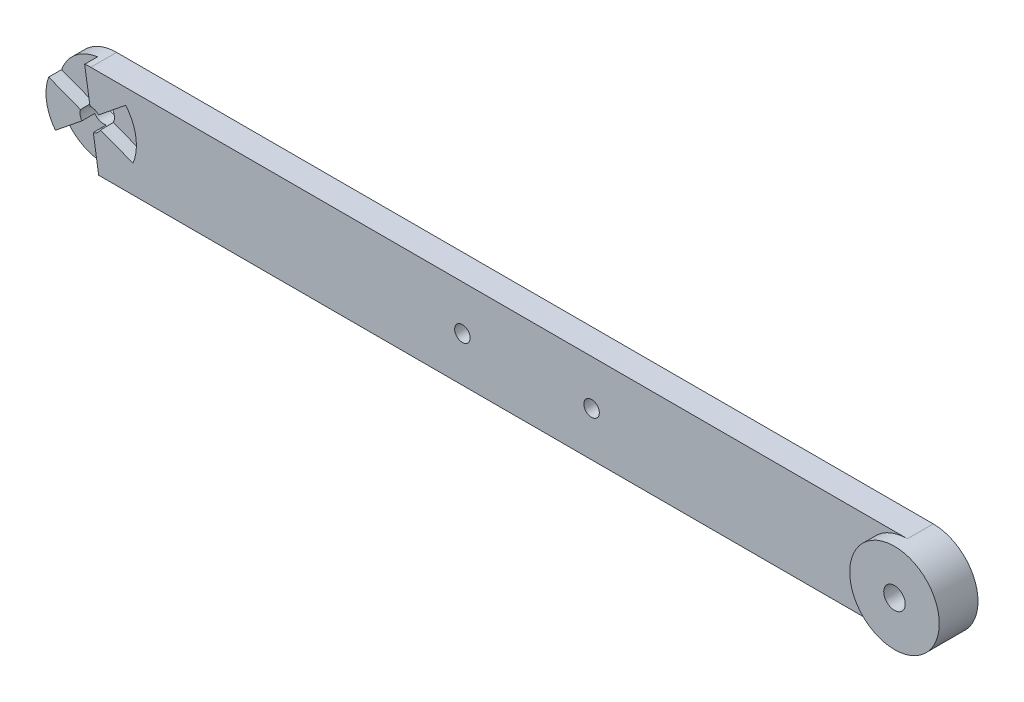
from build123d import *
from build123d.topology import SkipClean

# Parameters (mm, degrees)
SKETCH1_R            = 2.5
BOSS_EXTRUDE1_DEPTH  = 6
CUT_EXTRUDE3_DEPTH   = 3
BOSS_EXTRUDE2_START  = 3
SKETCH4_R            = 2.5
BOSS_EXTRUDE2_DEPTH  = 3
M3_CLEARANCE_HOLE1_D = 3.6


with BuildPart() as part:
    # Sketch1 → Boss-Extrude1 (new body)
    with BuildSketch(Plane.XY):
        with BuildLine():
            Line((189.7, -10.4), (0, -10.4))
            ThreePointArc((0, -10.4), (-10.4, 0), (0, 10.4))
            Line((0, 10.4), (189.7, 10.4))
            ThreePointArc((189.7, 10.4), (200.1, 0), (189.7, -10.4))
        make_face()
        Circle(SKETCH1_R, mode=Mode.SUBTRACT)
        with Locations((189.7, 0)):
            Circle(SKETCH1_R, mode=Mode.SUBTRACT)
    extrude(amount=BOSS_EXTRUDE1_DEPTH)

    # Sketch6 → Cut-Extrude3 (cut)
    with BuildSketch(Plane(origin=(0, 0, 0), x_dir=(-1, 0, 0), z_dir=(0, 0, -1))):
        with BuildLine():
            ThreePointArc((0.189684667, 2.492793559), (1.571265552, 1.944511395), (2.39740304, 0.708843186))
            Line((2.39740304, 0.708843186), (9.962077265, 3.621742201))
            ThreePointArc((9.962077265, 3.621742201), (6.66216594, 8.244728315), (1.449377234, 10.500443116))
            Line((1.449377234, 10.500443116), (0.189684667, 2.492793559))
        make_face()
        with BuildLine():
            ThreePointArc((2.063980215, -1.41066852), (0.89836349, -2.333011582), (-0.584825314, -2.430633529))
            Line((-0.584825314, -2.430633529), (-1.844517881, -10.438283086))
            ThreePointArc((-1.844517881, -10.438283086), (3.809061198, -9.891969106), (8.368961872, -6.505419062))
            Line((8.368961872, -6.505419062), (2.063980215, -1.41066852))
        make_face()
        with BuildLine():
            Line((-9.818339107, -3.995024054), (-2.253664882, -1.082125039))
            ThreePointArc((-2.253664882, -1.082125039), (-2.469629042, 0.388500187), (-1.812577726, 1.721790343))
            Line((-1.812577726, 1.721790343), (-8.117559384, 6.816540886))
            ThreePointArc((-8.117559384, 6.816540886), (-10.471227138, 1.647240791), (-9.818339107, -3.995024054))
        make_face()
    extrude(amount=-CUT_EXTRUDE3_DEPTH, mode=Mode.SUBTRACT)

    # Sketch4 → Boss-Extrude2 (add)
    with SkipClean():  # the faces are left unmerged after this step: merging them gives an invalid solid
        with BuildSketch(Plane(origin=(0, 0, 0), x_dir=(-1, 0, 0), z_dir=(0, 0, -1)).offset(BOSS_EXTRUDE2_START)):
            with BuildLine():
                ThreePointArc((-189.7, 10.4), (-200.1, 0), (-189.7, -10.4))
                ThreePointArc((-189.7, -10.4), (-179.3, 0), (-189.7, 10.4))
            make_face()
            with Locations((-189.7, 0)):
                Circle(SKETCH4_R, mode=Mode.SUBTRACT)
        extrude(amount=-BOSS_EXTRUDE2_DEPTH)


with BuildPart() as body_2:
    # Mirror1: mirrored copy
    add(part.part.mirror(Plane.XY))

    # M3 Clearance Hole1 (through all)
    with Locations(Plane(origin=(0, 0, -6), x_dir=(-1, 0, 0), z_dir=(0, 0, -1))):
        with Locations((-116.336074354, -0.050784287), (-86.336165629, 0.001543951)):
            Hole(M3_CLEARANCE_HOLE1_D / 2)


solid = body_2.part
